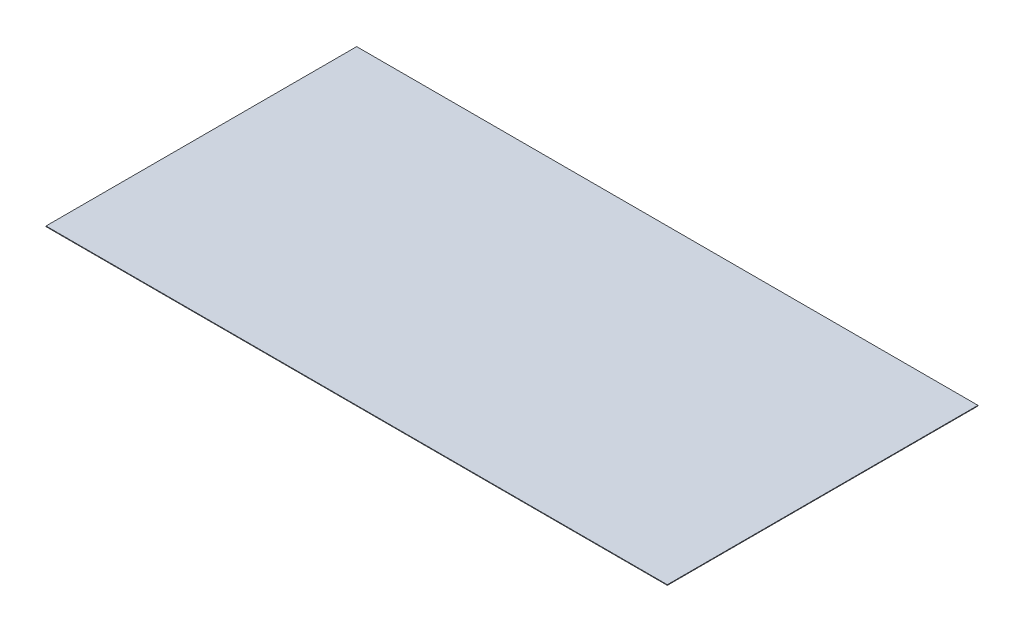
from build123d import *

# Parameters (mm, degrees)
SKETCH1_W           = 6700
SKETCH1_H           = 3350
BOSS_EXTRUDE1_DEPTH = 6.35


with BuildPart() as part:
    # Sketch1 → Boss-Extrude1 (new body)
    with BuildSketch(Plane(origin=(0, 0, 0), x_dir=(1, 0, 0), z_dir=(0, 1, 0))):
        Rectangle(SKETCH1_W, SKETCH1_H)
    extrude(amount=BOSS_EXTRUDE1_DEPTH)


solid = part.part
